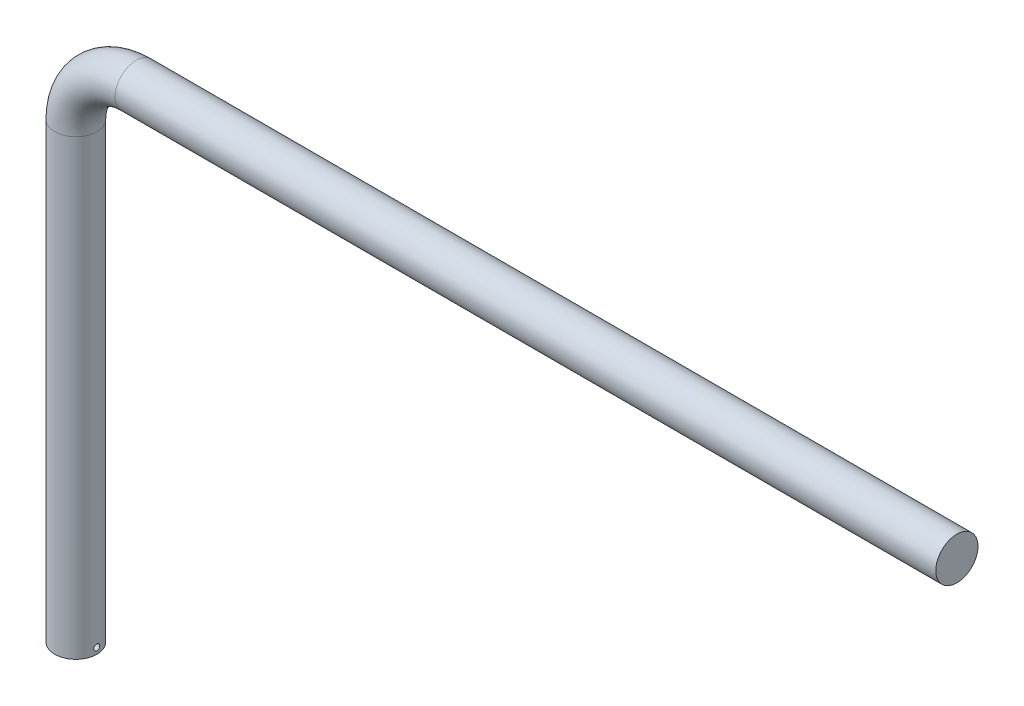
from build123d import *

# Parameters (mm, degrees)
SKETCH5_R               = 3.5
CUT_EXTRUDE3_DEPTH      = 173.444918744
CUT_EXTRUDE3_DEPTH_BACK = 173.444918744
SKETCH9_R               = 0.5


with BuildPart() as part:
    # Sweep1: sweep along a path in Sketch1
    with BuildLine(Plane.XY) as sweep1_path:
        Line((0, 0), (-136, 0))
        ThreePointArc((-136, 0), (-143.071067812, -2.928932188), (-146, -10))
        Line((-146, -10), (-146, -85))
    # Sketch5 → Sweep1 (sweep)
    with BuildSketch(Plane(origin=(0, 0, 0), x_dir=(0, 0, -1), z_dir=(1, 0, 0))):
        Circle(SKETCH5_R)
    sweep(path=sweep1_path.line)

    # Sketch9 → Cut-Extrude3 (cut, two sides: drawn at the far end of the back side and taken through both)
    with BuildSketch(Plane(origin=(-150, 0, 0), x_dir=(0, 0, -1), z_dir=(1, 0, 0)).offset(-CUT_EXTRUDE3_DEPTH_BACK)):
        with Locations(Location((0, -84, 0), (0, 0, 180))):
            Circle(SKETCH9_R)
    extrude(amount=CUT_EXTRUDE3_DEPTH + CUT_EXTRUDE3_DEPTH_BACK, mode=Mode.SUBTRACT)


solid = part.part
